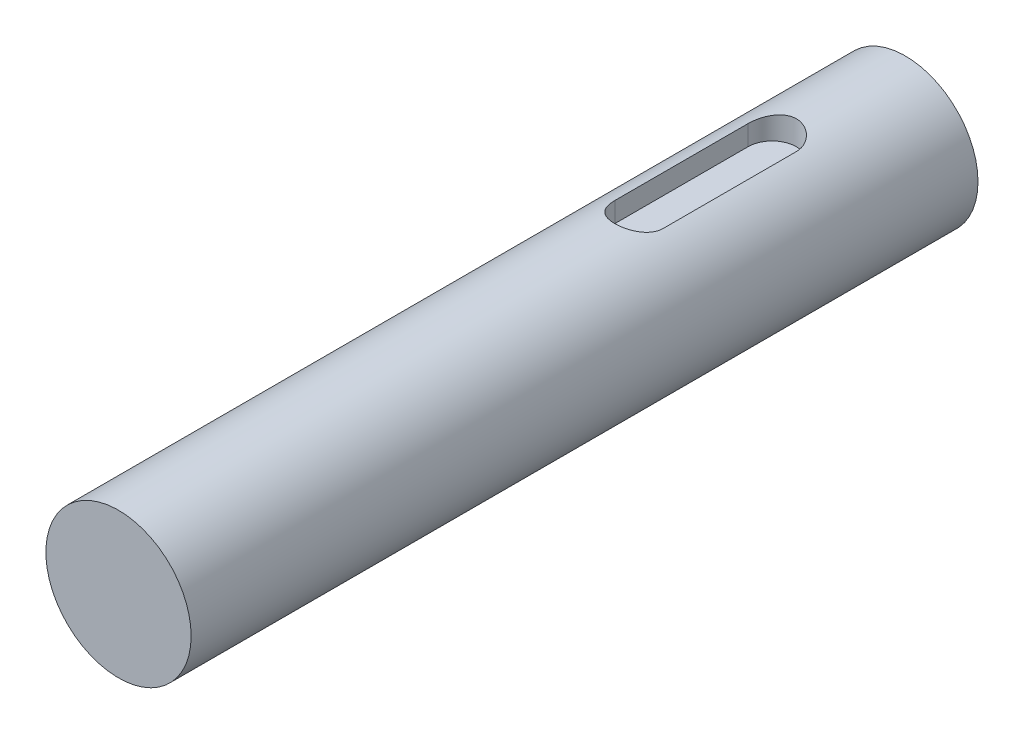
from build123d import *

# Parameters (mm, degrees)
ESQUISSE1_R             = 6
BOSS_EXTRU_1_DEPTH      = 50
ENL_V_MAT_EXTRU_3_DEPTH = 2
BOSS_EXTRU_2_START      = 15
ESQUISSE4_R             = 6
BOSS_EXTRU_2_DEPTH      = 15


with BuildPart() as part:
    # Esquisse1 → Boss.-Extru.1 (new body)
    with BuildSketch(Plane.XY):
        Circle(ESQUISSE1_R)
    extrude(amount=-BOSS_EXTRU_1_DEPTH)

    # Esquisse3 → Enlèv. mat.-Extru.3 (cut)
    with BuildSketch(Plane(origin=(0, 6, 0), x_dir=(1, 0, 0), z_dir=(0, 1, 0))):
        with BuildLine():
            Line((2, 39), (2, 28))
            ThreePointArc((2, 28), (0, 26), (-2, 28))
            Line((-2, 28), (-2, 39))
            ThreePointArc((-2, 39), (0, 41), (2, 39))
        make_face()
    extrude(amount=-ENL_V_MAT_EXTRU_3_DEPTH, mode=Mode.SUBTRACT)

    # Esquisse4 → Boss.-Extru.2 (add)
    with BuildSketch(Plane.XY.offset(BOSS_EXTRU_2_START)):
        Circle(ESQUISSE4_R)
    extrude(amount=-BOSS_EXTRU_2_DEPTH)


solid = part.part
